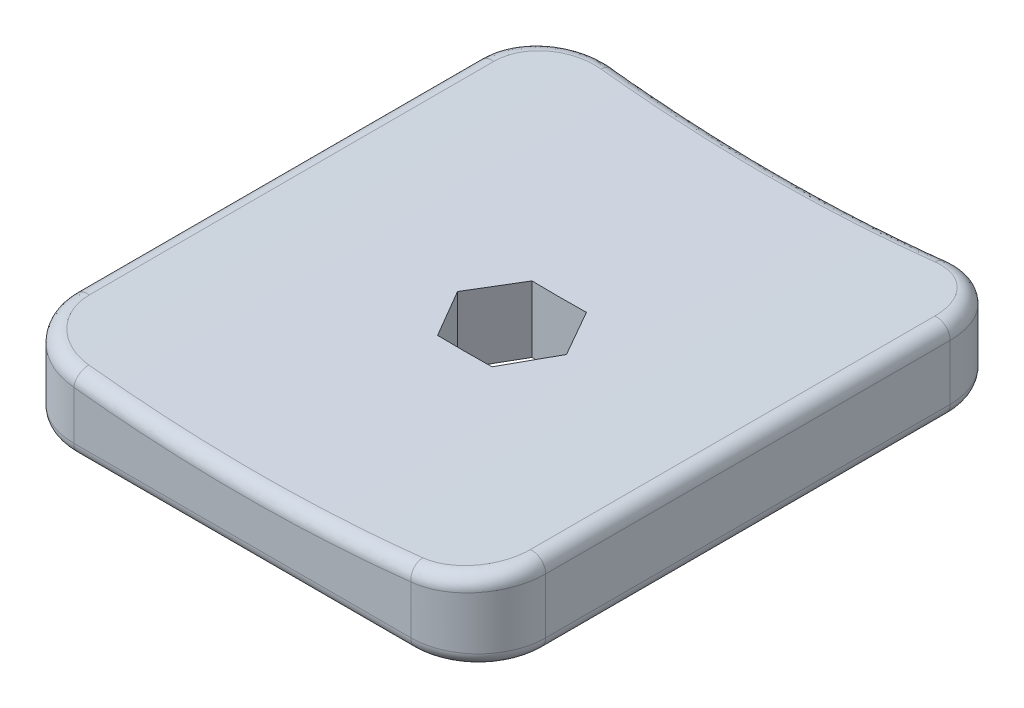
from build123d import *

# Parameters (mm, degrees)
BOSS_EXTRUDE1_DEPTH = 6.27
CUT_EXTRUDE1_DEPTH  = 45.108535455
FILLET1_R           = 1


with BuildPart() as part:
    # Sketch1 → Boss-Extrude1 (new body)
    with BuildSketch(Plane(origin=(0, 0, 0), x_dir=(1, 0, 0), z_dir=(0, 1, 0))):
        with BuildLine():
            Line((12.5, -20), (-12.5, -20))
            ThreePointArc((-12.5, -20), (-16.035533906, -18.535533906), (-17.5, -15))
            Line((-17.5, -15), (-17.5, 15))
            ThreePointArc((-17.5, 15), (-16.035533906, 18.535533906), (-12.5, 20))
            Line((-12.5, 20), (12.5, 20))
            ThreePointArc((12.5, 20), (16.035533906, 18.535533906), (17.5, 15))
            Line((17.5, 15), (17.5, -15))
            ThreePointArc((17.5, -15), (16.035533906, -18.535533906), (12.5, -20))
        make_face()
        Polygon((4.041451884, 0), (2.020725942, 3.5), (-2.020725942, 3.5), (-4.041451884, 0), (-2.020725942, -3.5), (2.020725942, -3.5), align=None, mode=Mode.SUBTRACT)
    extrude(amount=-BOSS_EXTRUDE1_DEPTH)

    # Sketch2 → Cut-Extrude1 (cut, through all)
    with BuildSketch(Plane.XY.offset(20)):
        with BuildLine():
            Line((17.5, 0), (-17.5, 0))
            add(Edge.make_bspline(
                [(-17.5, 0), (0, -2.74), (17.5, 0)],
                knots=[0, 0, 0, 1, 1, 1], degree=2))
        make_face()
    extrude(amount=-CUT_EXTRUDE1_DEPTH, mode=Mode.SUBTRACT)

    # Fillet1
    fillet1_edges = [part.edges().sort_by_distance(p)[0] for p in [
        (-16.035533906, -6.27, -18.535533906),
        (-17.5, -6.27, 0),
        (-16.035533906, -6.27, 18.535533906),
        (0, -6.27, 20),
        (16.035533906, -6.27, 18.535533906),
        (17.5, -6.27, 0),
        (16.035533906, -6.27, -18.535533906),
        (0, -1.37, 20),
        (16.029195497, -0.220608651, -18.541860972),
        (16.029195497, -0.22060865, 18.541860971),
        (-16.029195517, -0.220608648, 18.541860952),
        (-16.029195498, -0.220608651, -18.541860972),
        (0, -1.37, -20),
        (0, -6.27, -20),
        (17.5, 0, 0),
        (-17.5, 0, 0),
    ]]
    fillet(fillet1_edges, radius=FILLET1_R)


solid = part.part
